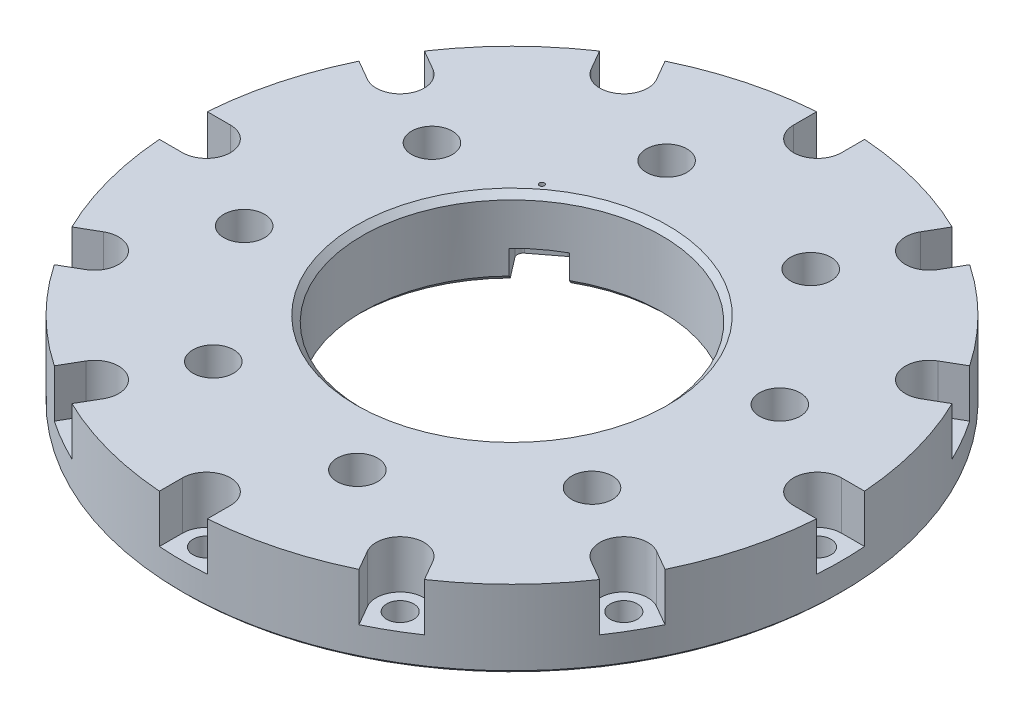
from build123d import *

# Parameters (mm, degrees)
SKETCH_1_W               = 30
SKETCH_1_H               = 13
CUT_EXTRUDE_1_DEPTH      = 8
SKETCH_3_R               = 2.25
CUT_EXTRUDE_2_DEPTH      = 79.192071209
PATTERN_CIRCULAR_1_COUNT = 12
CHAMFER_1_SIZE           = 1
CHAMFER_2_SIZE           = 0.5
HOLE_WIZARD_M8_2_D       = 6.8
PATTERN_CIRCULAR_2_COUNT = 8
CUT_EXTRUDE_3_DEPTH      = 5
FILLET_1_R               = 1
HOLE_WIZARD_M3_1_D       = 2.5
HOLE_WIZARD_M3_1_DEPTH   = 7.5
HOLE_WIZARD_M3_1_TIP     = 0.751075774


with BuildPart() as part:
    # 草图1 → 旋转1 (revolve)
    with BuildSketch(Plane.XY, mode=Mode.PRIVATE) as revolve_1_sk:
        with Locations((-40, -6.5)):
            Rectangle(SKETCH_1_W, SKETCH_1_H)
    revolve(revolve_1_sk.sketch.rotate(Axis((0, 0, 0), (0, -1, 0)), 270), axis=Axis((0, 0, 0), (0, -1, 0)))

    # 草图2 → 切除-拉伸1 (cut)
    with BuildSketch(Plane(origin=(0, 0, 0), x_dir=(1, 0, 0), z_dir=(0, 1, 0))):
        with BuildLine():
            Line((4, 65.625784045), (4, 51))
            ThreePointArc((4, 51), (0, 47), (-4, 51))
            Line((-4, 51), (-4, 65.625784045))
            ThreePointArc((-4, 65.625784045), (0, 69.625784045), (4, 65.625784045))
        make_face()
    cut_extrude_1 = extrude(amount=-CUT_EXTRUDE_1_DEPTH, mode=Mode.SUBTRACT)

    # 草图3 → 切除-拉伸2 (cut, through all)
    with BuildSketch(Plane(origin=(0, -8, 0), x_dir=(1, 0, 0), z_dir=(0, 1, 0))):
        with Locations(Location((0, 51, 0), (0, 0, 270))):
            Circle(SKETCH_3_R)
    cut_extrude_2 = extrude(amount=-CUT_EXTRUDE_2_DEPTH, mode=Mode.SUBTRACT)

    # 阵列(圆周)1: 切除-拉伸1, 切除-拉伸2 ×12 about axis
    pattern_circular_1_axis = Axis((0, 0, 0), (0, 1, 0))
    add([cut_extrude_1.rotate(pattern_circular_1_axis, i * 360 / PATTERN_CIRCULAR_1_COUNT) for i in range(1, PATTERN_CIRCULAR_1_COUNT)], mode=Mode.SUBTRACT)
    add([cut_extrude_2.rotate(pattern_circular_1_axis, i * 360 / PATTERN_CIRCULAR_1_COUNT) for i in range(1, PATTERN_CIRCULAR_1_COUNT)], mode=Mode.SUBTRACT)

    # 倒角1
    chamfer_1_edges = [part.edges().sort_by_distance(p)[0] for p in [
        (0, 0, -25),
        (0, -13, -25),
    ]]
    chamfer(chamfer_1_edges, length=CHAMFER_1_SIZE)

    # 倒角2
    chamfer_2_edges = [part.edges().sort_by_distance(p)[0] for p in [
        (0, -13, -55),
    ]]
    chamfer(chamfer_2_edges, length=CHAMFER_2_SIZE)

    # M8 螺纹孔2 (through all)
    with Locations(Plane(origin=(0, 0, 0), x_dir=(1, 0, 0), z_dir=(0, 1, 0))):
        with Locations((35.25629266, 9.446895146)):
            hole_wizard_m8_2 = Hole(HOLE_WIZARD_M8_2_D / 2)

    # 阵列(圆周)2: M8 螺纹孔2 ×8 about axis
    pattern_circular_2_axis = Axis((0, 0, 0), (0, 1, 0))
    for i in range(1, PATTERN_CIRCULAR_2_COUNT):
        add(hole_wizard_m8_2.rotate(pattern_circular_2_axis, i * 360 / PATTERN_CIRCULAR_2_COUNT), mode=Mode.SUBTRACT)

    # 草图8 → 切除-拉伸3 (cut)
    with BuildSketch(Plane.XZ.offset(13)):
        Polygon((-21.727676324, -22.402412405), (-14.422539176, -12.882172321), (-8.710395126, -17.26525461), (-16.015532274, -26.785494693), align=None)
    extrude(amount=-CUT_EXTRUDE_3_DEPTH, mode=Mode.SUBTRACT)

    # 圆角1
    fillet_1_edges = [part.edges().sort_by_distance(p)[0] for p in [
        (-16.015532274, -10.5, -26.785494693),
        (-21.727676324, -10.5, -22.402412405),
    ]]
    fillet(fillet_1_edges, radius=FILLET_1_R)

    # M3 螺纹孔1
    with Locations(Plane(origin=(0, -8, 0), x_dir=(-1, 0, 0), z_dir=(0, -1, 0))):
        with Locations((16.436558583, 21.420540188)):
            Hole(HOLE_WIZARD_M3_1_D / 2, depth=HOLE_WIZARD_M3_1_DEPTH)
            with Locations((0, 0, -(HOLE_WIZARD_M3_1_DEPTH + HOLE_WIZARD_M3_1_TIP / 2))):  # 118° drill point
                Cone(0, HOLE_WIZARD_M3_1_D / 2, HOLE_WIZARD_M3_1_TIP, mode=Mode.SUBTRACT)


solid = part.part
